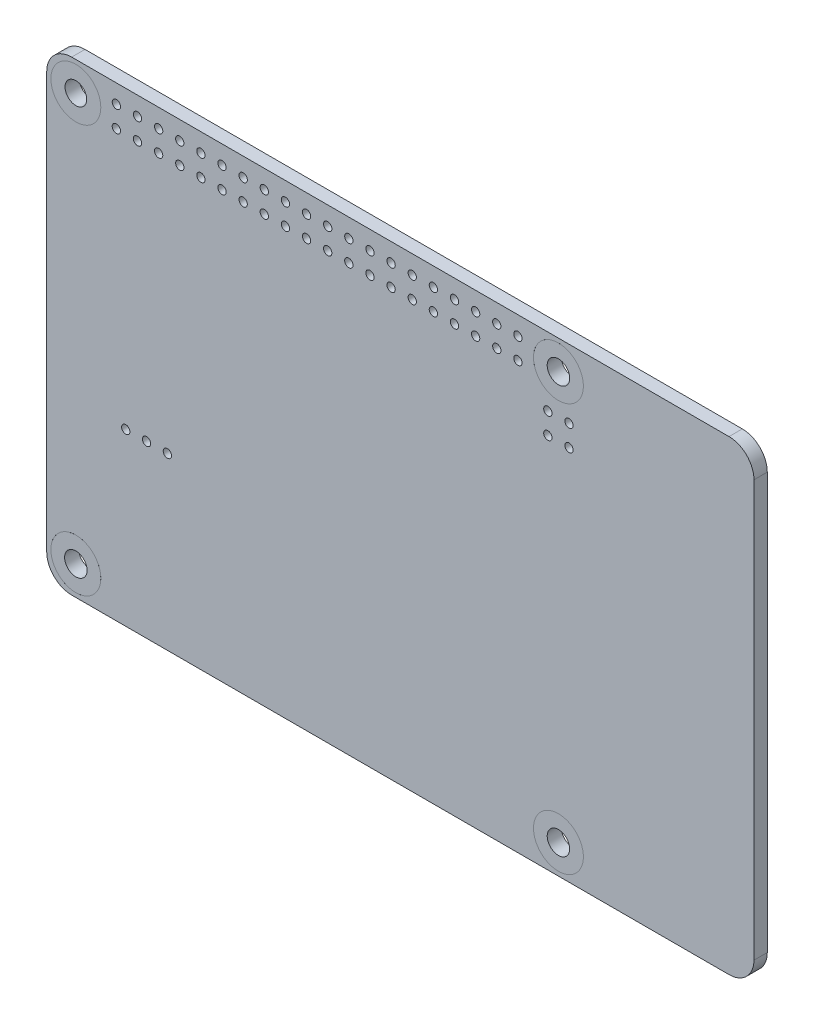
from build123d import *

# Parameters (mm, degrees)
BOSS_EXTRUDE1_DEPTH   = 1.6
SKETCH3_R             = 3
CUT_EXTRUDE1_DEPTH    = 51.919642575
SKETCH4_R             = 3
SKETCH4_R_2           = 1.35
BOSS_EXTRUDE2_DEPTH   = 1.7
BOSS_EXTRUDE2_2_DEPTH = 1.7
BOSS_EXTRUDE2_3_DEPTH = 1.7
SKETCH4_R_3           = 1.3
BOSS_EXTRUDE2_4_DEPTH = 1.7
SKETCH5_R             = 0.5
CUT_EXTRUDE2_DEPTH    = 51.922882872
SKETCH6_R             = 0.5
CUT_EXTRUDE3_DEPTH    = 51.922882872
SKETCH7_R             = 0.5
CUT_EXTRUDE4_DEPTH    = 51.922882872


with BuildPart() as part:
    # Sketch1 → Boss-Extrude1 (new body)
    with BuildSketch(Plane.XY):
        with BuildLine():
            Line((-39.5, -28), (39.5, -28))
            ThreePointArc((39.5, -28), (41.621320344, -27.121320344), (42.5, -25))
            Line((42.5, -25), (42.5, 25))
            ThreePointArc((42.5, 25), (41.621320344, 27.121320344), (39.5, 28))
            Line((39.5, 28), (-39.5, 28))
            ThreePointArc((-39.5, 28), (-41.621320344, 27.121320344), (-42.5, 25))
            Line((-42.5, 25), (-42.5, -25))
            ThreePointArc((-42.5, -25), (-41.621320344, -27.121320344), (-39.5, -28))
        make_face()
    extrude(amount=BOSS_EXTRUDE1_DEPTH)

    # Sketch3 → Cut-Extrude1 (cut, through all)
    with BuildSketch(Plane.XY.offset(1.6)):
        with Locations((-39, 24.5)):
            Circle(SKETCH3_R)
        with Locations(Location((-39, -24.5, 0), (0, 0, 180))):
            Circle(SKETCH3_R)
        with Locations((19, -24.5)):
            Circle(SKETCH3_R)
        with Locations(Location((19, 24.5, 0), (0, 0, 180))):
            Circle(SKETCH3_R)
    extrude(amount=-CUT_EXTRUDE1_DEPTH, mode=Mode.SUBTRACT)

    # Sketch5 → Cut-Extrude2 (cut, through all)
    with BuildSketch(Plane.XY.offset(1.6)):
        with Locations((-33, -7.5)):
            Circle(SKETCH5_R)
        with Locations((-30.5, -7.5)):
            Circle(SKETCH5_R)
        with Locations((-28, -7.5)):
            Circle(SKETCH5_R)
    extrude(amount=-CUT_EXTRUDE2_DEPTH, mode=Mode.SUBTRACT)

    # Sketch6 → Cut-Extrude3 (cut, through all)
    with BuildSketch(Plane.XY.offset(1.6)):
        with Locations((-34.13, 25.77)):
            Circle(SKETCH6_R)
        with Locations((-34.13, 23.23)):
            Circle(SKETCH6_R)
        with Locations((-31.59, 25.77)):
            Circle(SKETCH6_R)
        with Locations((-31.59, 23.23)):
            Circle(SKETCH6_R)
        with Locations((-29.05, 25.77)):
            Circle(SKETCH6_R)
        with Locations((-29.05, 23.23)):
            Circle(SKETCH6_R)
        with Locations((-26.51, 25.77)):
            Circle(SKETCH6_R)
        with Locations((-26.51, 23.23)):
            Circle(SKETCH6_R)
        with Locations((-23.97, 25.77)):
            Circle(SKETCH6_R)
        with Locations((-23.97, 23.23)):
            Circle(SKETCH6_R)
        with Locations((-21.43, 25.77)):
            Circle(SKETCH6_R)
        with Locations((-21.43, 23.23)):
            Circle(SKETCH6_R)
        with Locations((-18.89, 25.77)):
            Circle(SKETCH6_R)
        with Locations((-18.89, 23.23)):
            Circle(SKETCH6_R)
        with Locations((-16.35, 25.77)):
            Circle(SKETCH6_R)
        with Locations((-16.35, 23.23)):
            Circle(SKETCH6_R)
        with Locations((-13.81, 25.77)):
            Circle(SKETCH6_R)
        with Locations((-13.81, 23.23)):
            Circle(SKETCH6_R)
        with Locations((-11.27, 25.77)):
            Circle(SKETCH6_R)
        with Locations((-11.27, 23.23)):
            Circle(SKETCH6_R)
        with Locations((-8.73, 25.77)):
            Circle(SKETCH6_R)
        with Locations((-8.73, 23.23)):
            Circle(SKETCH6_R)
        with Locations((-6.19, 25.77)):
            Circle(SKETCH6_R)
        with Locations((-6.19, 23.23)):
            Circle(SKETCH6_R)
        with Locations((-3.65, 25.77)):
            Circle(SKETCH6_R)
        with Locations((-3.65, 23.23)):
            Circle(SKETCH6_R)
        with Locations((-1.11, 25.77)):
            Circle(SKETCH6_R)
        with Locations((-1.11, 23.23)):
            Circle(SKETCH6_R)
        with Locations((1.43, 25.77)):
            Circle(SKETCH6_R)
        with Locations((1.43, 23.23)):
            Circle(SKETCH6_R)
        with Locations((3.97, 25.77)):
            Circle(SKETCH6_R)
        with Locations((3.97, 23.23)):
            Circle(SKETCH6_R)
        with Locations((6.51, 25.77)):
            Circle(SKETCH6_R)
        with Locations((6.51, 23.23)):
            Circle(SKETCH6_R)
        with Locations((9.05, 25.77)):
            Circle(SKETCH6_R)
        with Locations((9.05, 23.23)):
            Circle(SKETCH6_R)
        with Locations((11.59, 25.77)):
            Circle(SKETCH6_R)
        with Locations((11.59, 23.23)):
            Circle(SKETCH6_R)
        with Locations((14.13, 25.77)):
            Circle(SKETCH6_R)
        with Locations((14.13, 23.23)):
            Circle(SKETCH6_R)
    extrude(amount=-CUT_EXTRUDE3_DEPTH, mode=Mode.SUBTRACT)

    # Sketch7 → Cut-Extrude4 (cut, through all)
    with BuildSketch(Plane.XY.offset(1.6)):
        with Locations((20.27, 19.77)):
            Circle(SKETCH7_R)
        with Locations((17.73, 19.77)):
            Circle(SKETCH7_R)
        with Locations((17.73, 17.23)):
            Circle(SKETCH7_R)
        with Locations((20.27, 17.23)):
            Circle(SKETCH7_R)
    extrude(amount=-CUT_EXTRUDE4_DEPTH, mode=Mode.SUBTRACT)


with BuildPart() as body_2:
    # Sketch4 → Boss-Extrude2 (new body)
    with BuildSketch(Plane.XY.offset(1.6)):
        with Locations((-39, -24.5)):
            Circle(SKETCH4_R)
        with Locations((-39, -24.5)):
            Circle(SKETCH4_R_2, mode=Mode.SUBTRACT)
    extrude(amount=-BOSS_EXTRUDE2_DEPTH)


with BuildPart() as body_3:
    # Sketch4 → Boss-Extrude2 2 (new body)
    with BuildSketch(Plane.XY.offset(1.6)):
        with Locations((19, -24.5)):
            Circle(SKETCH4_R)
        with Locations((19, -24.5)):
            Circle(SKETCH4_R_2, mode=Mode.SUBTRACT)
    extrude(amount=-BOSS_EXTRUDE2_2_DEPTH)


with BuildPart() as body_4:
    # Sketch4 → Boss-Extrude2 3 (new body)
    with BuildSketch(Plane.XY.offset(1.6)):
        with Locations((19, 24.5)):
            Circle(SKETCH4_R)
        with Locations((19, 24.5)):
            Circle(SKETCH4_R_2, mode=Mode.SUBTRACT)
    extrude(amount=-BOSS_EXTRUDE2_3_DEPTH)


with BuildPart() as body_5:
    # Sketch4 → Boss-Extrude2 4 (new body)
    with BuildSketch(Plane.XY.offset(1.6)):
        with Locations((-39, 24.5)):
            Circle(SKETCH4_R)
        with Locations((-39, 24.5)):
            Circle(SKETCH4_R_3, mode=Mode.SUBTRACT)
    extrude(amount=-BOSS_EXTRUDE2_4_DEPTH)


solid = Compound([part.part, body_2.part, body_3.part, body_4.part, body_5.part])
